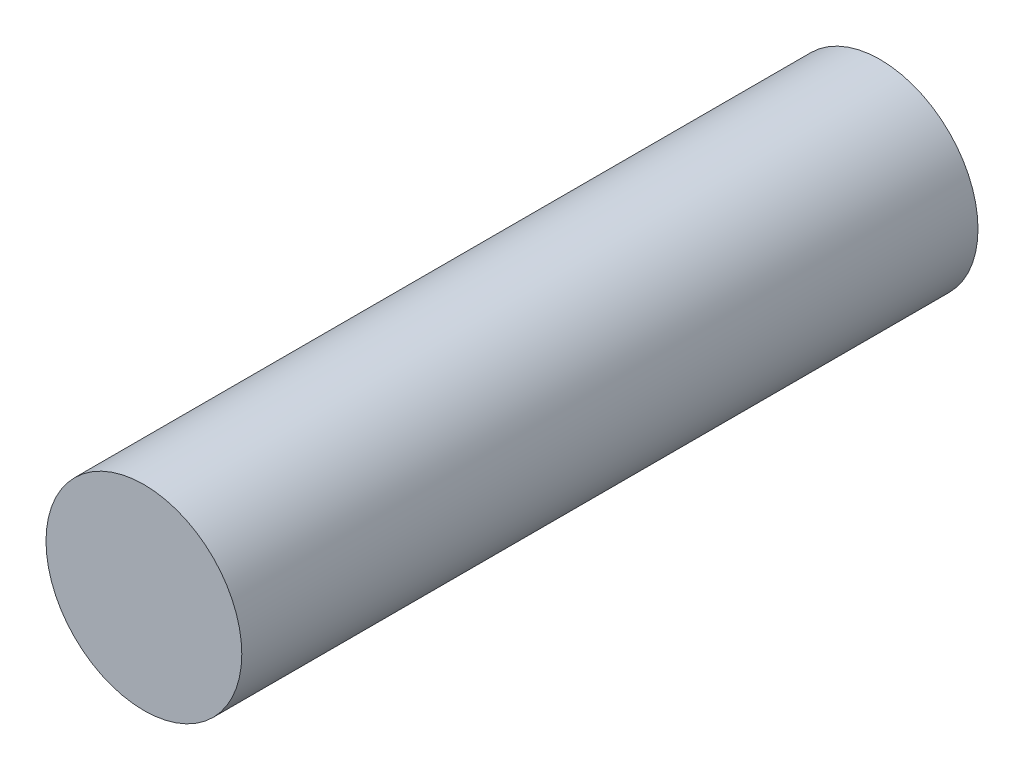
from build123d import *

# Parameters (mm, degrees)
SKETCH1_R           = 6.42
BOSS_EXTRUDE1_DEPTH = 48.28


with BuildPart() as part:
    # Sketch1 → Boss-Extrude1 (new body)
    with BuildSketch(Plane.XY):
        Circle(SKETCH1_R)
    extrude(amount=BOSS_EXTRUDE1_DEPTH)


solid = part.part
